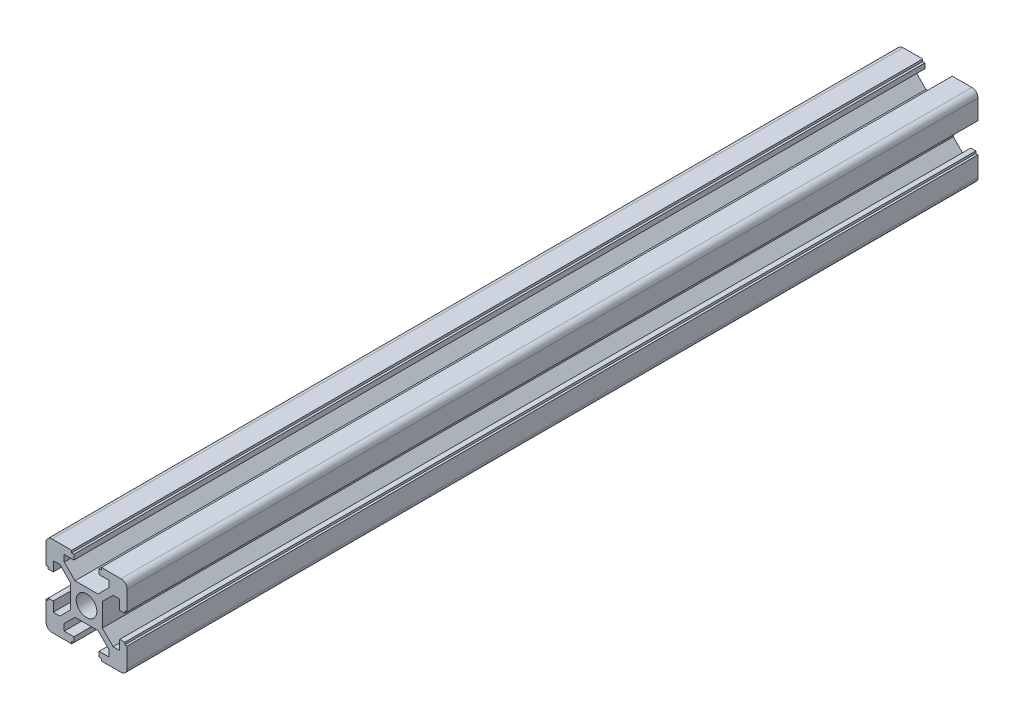
from build123d import *

# Parameters (mm, degrees)
SKETCH_2_R      = 2.55
EXTRUDE_1_DEPTH = 210


with BuildPart() as part:
    # 草图2 → 凸台-拉伸1 (new body)
    with BuildSketch(Plane.XY):
        with BuildLine():
            Line((-3.9, 2.839339828), (-6.560660172, 5.5))
            Line((-6.560660172, 5.5), (-8.2, 5.5))
            Line((-8.2, 5.5), (-8.2, 3.1))
            Line((-8.2, 3.1), (-9.45, 3.1))
            Line((-9.45, 3.1), (-9.45, 3.65))
            Line((-9.45, 3.65), (-10, 3.65))
            Line((-10, 3.65), (-10, 8.5))
            ThreePointArc((-10, 8.5), (-9.560660172, 9.560660172), (-8.5, 10))
            Line((-8.5, 10), (-3.65, 10))
            Line((-3.65, 10), (-3.65, 9.45))
            Line((-3.65, 9.45), (-3.1, 9.45))
            Line((-3.1, 9.45), (-3.1, 8.2))
            Line((-3.1, 8.2), (-5.5, 8.2))
            Line((-5.5, 8.2), (-5.5, 6.560660172))
            Line((-5.5, 6.560660172), (-2.839339828, 3.9))
            Line((-2.839339828, 3.9), (2.839339828, 3.9))
            Line((2.839339828, 3.9), (5.5, 6.560660172))
            Line((5.5, 6.560660172), (5.5, 8.2))
            Line((5.5, 8.2), (3.1, 8.2))
            Line((3.1, 8.2), (3.1, 9.45))
            Line((3.1, 9.45), (3.65, 9.45))
            Line((3.65, 9.45), (3.65, 10))
            Line((3.65, 10), (8.5, 10))
            ThreePointArc((8.5, 10), (9.560660172, 9.560660172), (10, 8.5))
            Line((10, 8.5), (10, 3.65))
            Line((10, 3.65), (9.45, 3.65))
            Line((9.45, 3.65), (9.45, 3.1))
            Line((9.45, 3.1), (8.2, 3.1))
            Line((8.2, 3.1), (8.2, 5.5))
            Line((8.2, 5.5), (6.560660172, 5.5))
            Line((6.560660172, 5.5), (3.9, 2.839339828))
            Line((3.9, 2.839339828), (3.9, -2.839339828))
            Line((3.9, -2.839339828), (6.560660172, -5.5))
            Line((6.560660172, -5.5), (8.2, -5.5))
            Line((8.2, -5.5), (8.2, -3.1))
            Line((8.2, -3.1), (9.45, -3.1))
            Line((9.45, -3.1), (9.45, -3.65))
            Line((9.45, -3.65), (10, -3.65))
            Line((10, -3.65), (10, -8.5))
            ThreePointArc((10, -8.5), (9.560660172, -9.560660172), (8.5, -10))
            Line((8.5, -10), (3.65, -10))
            Line((3.65, -10), (3.65, -9.45))
            Line((3.65, -9.45), (3.1, -9.45))
            Line((3.1, -9.45), (3.1, -8.2))
            Line((3.1, -8.2), (5.5, -8.2))
            Line((5.5, -8.2), (5.5, -6.560660172))
            Line((5.5, -6.560660172), (2.839339828, -3.9))
            Line((2.839339828, -3.9), (-2.839339828, -3.9))
            Line((-2.839339828, -3.9), (-5.5, -6.560660172))
            Line((-5.5, -6.560660172), (-5.5, -8.2))
            Line((-5.5, -8.2), (-3.1, -8.2))
            Line((-3.1, -8.2), (-3.1, -9.45))
            Line((-3.1, -9.45), (-3.65, -9.45))
            Line((-3.65, -9.45), (-3.65, -10))
            Line((-3.65, -10), (-8.5, -10))
            ThreePointArc((-8.5, -10), (-9.560660172, -9.560660172), (-10, -8.5))
            Line((-10, -8.5), (-10, -3.65))
            Line((-10, -3.65), (-9.45, -3.65))
            Line((-9.45, -3.65), (-9.45, -3.1))
            Line((-9.45, -3.1), (-8.2, -3.1))
            Line((-8.2, -3.1), (-8.2, -5.5))
            Line((-8.2, -5.5), (-6.560660172, -5.5))
            Line((-6.560660172, -5.5), (-3.9, -2.839339828))
            Line((-3.9, -2.839339828), (-3.9, 2.839339828))
        make_face()
        Circle(SKETCH_2_R, mode=Mode.SUBTRACT)
    extrude(amount=EXTRUDE_1_DEPTH)


solid = part.part
